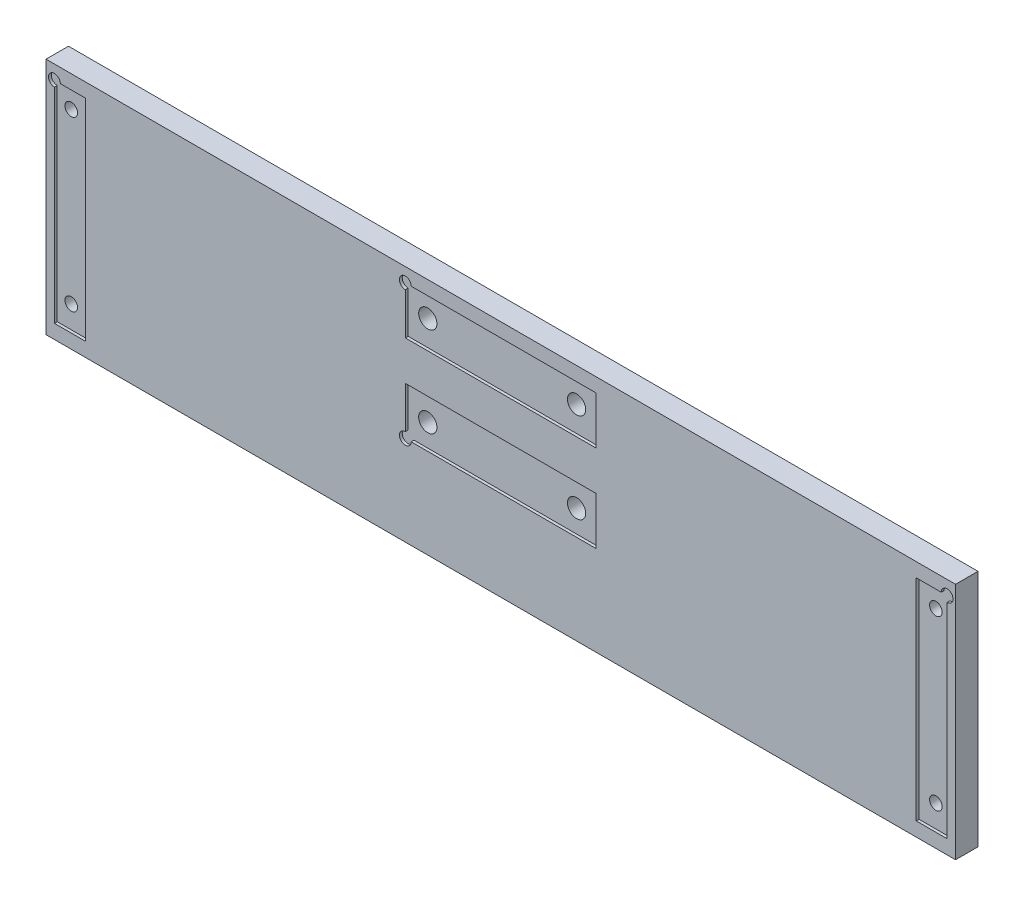
from build123d import *

# Parameters (mm, degrees)
ESQUISSE1_W             = 324
ESQUISSE1_H             = 85
BOSS_EXTRU_1_DEPTH      = 8
ENL_V_MAT_EXTRU_1_DEPTH = 1
ESQUISSE3_R             = 2.25
ENL_V_MAT_EXTRU_2_DEPTH = 168.628309065
ENL_V_MAT_EXTRU_3_DEPTH = 1
ESQUISSE5_R             = 3.25
ENL_V_MAT_EXTRU_4_DEPTH = 168.628309065


with BuildPart() as part:
    # Esquisse1 → Boss.-Extru.1 (new body)
    with BuildSketch(Plane.XY):
        Rectangle(ESQUISSE1_W, ESQUISSE1_H)
    extrude(amount=BOSS_EXTRU_1_DEPTH)

    # Esquisse2 → Enlèv. mat.-Extru.1 (cut)
    with BuildSketch(Plane.XY.offset(8)):
        with BuildLine():
            Line((148, 37.5), (156.9, 37.5))
            ThreePointArc((156.9, 37.5), (160.48492424, 38.98492424), (159, 35.4))
            Line((159, 35.4), (159, -37.5))
            Line((159, -37.5), (148, -37.5))
            Line((148, -37.5), (148, 37.5))
        make_face()
    enl_v_mat_extru_1 = extrude(amount=-ENL_V_MAT_EXTRU_1_DEPTH, mode=Mode.SUBTRACT)

    # Symétrie1: Enlèv. mat.-Extru.1 across plane
    add(enl_v_mat_extru_1.mirror(Plane(origin=(0, 0, 0), x_dir=(0, 0, 1), z_dir=(1, 0, 0))), mode=Mode.SUBTRACT)

    # Esquisse3 → Enlèv. mat.-Extru.2 (cut, through all)
    with BuildSketch(Plane.XY.offset(7)):
        with Locations((154, 30.5)):
            Circle(ESQUISSE3_R)
        with Locations(Location((154, -29.5, 0), (0, 0, 180))):
            Circle(ESQUISSE3_R)
    enl_v_mat_extru_2 = extrude(amount=-ENL_V_MAT_EXTRU_2_DEPTH, mode=Mode.SUBTRACT)

    # Symétrie2: Enlèv. mat.-Extru.2 across plane
    add(enl_v_mat_extru_2.mirror(Plane(origin=(0, 0, 0), x_dir=(0, 0, 1), z_dir=(1, 0, 0))), mode=Mode.SUBTRACT)

    # Esquisse4 → Enlèv. mat.-Extru.3 (cut)
    with BuildSketch(Plane.XY.offset(8)):
        with BuildLine():
            Line((-31.9, 37.5), (34, 37.5))
            Line((34, 37.5), (34, 20.5))
            Line((34, 20.5), (-34, 20.5))
            Line((-34, 20.5), (-34, 35.4))
            ThreePointArc((-34, 35.4), (-35.48492424, 38.98492424), (-31.9, 37.5))
        make_face()
        with BuildLine():
            Line((34, -10.5), (34, 6.5))
            Line((34, 6.5), (-34, 6.5))
            Line((-34, 6.5), (-34, -8.4))
            ThreePointArc((-34, -8.4), (-35.48492424, -11.98492424), (-31.9, -10.5))
            Line((-31.9, -10.5), (34, -10.5))
        make_face()
    extrude(amount=-ENL_V_MAT_EXTRU_3_DEPTH, mode=Mode.SUBTRACT)

    # Esquisse5 → Enlèv. mat.-Extru.4 (cut, through all)
    with BuildSketch(Plane.XY.offset(7)):
        with Locations((-27, 29.5)):
            Circle(ESQUISSE5_R)
        with Locations(Location((26, 29.5, 0), (0, 0, 180))):
            Circle(ESQUISSE5_R)
        with Locations((26, -2.5)):
            Circle(ESQUISSE5_R)
        with Locations(Location((-27, -2.5, 0), (0, 0, 180))):
            Circle(ESQUISSE5_R)
    extrude(amount=-ENL_V_MAT_EXTRU_4_DEPTH, mode=Mode.SUBTRACT)


solid = part.part
